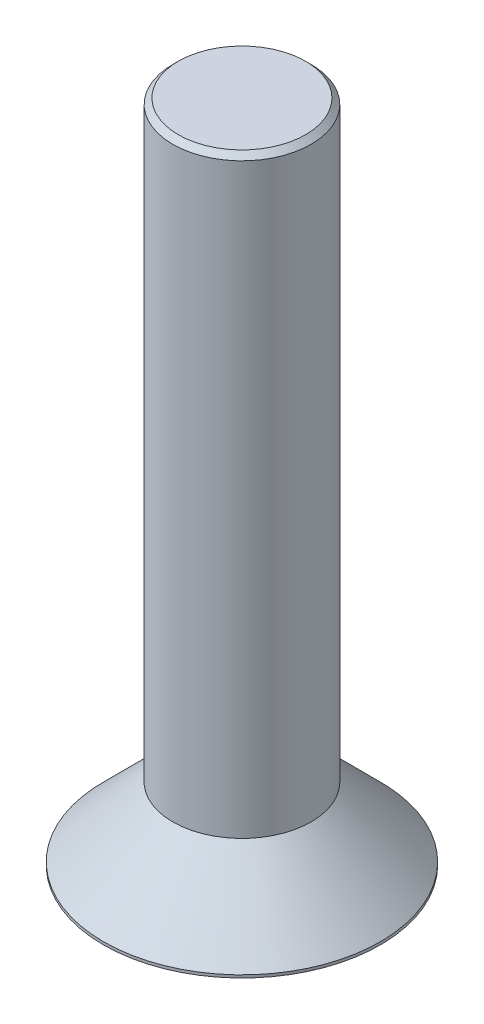
from build123d import *

# Parameters (mm, degrees)
SKETCH_1_R          = 5
EXTRUDE_1_DEPTH     = 2.6
CHAMFER_1_SIZE      = 2.5
CUT_EXTRUDE_1_DEPTH = 0.95
SKETCH_3_R          = 2.5
EXTRUDE_2_DEPTH     = 21.4
CHAMFER_2_SIZE      = 0.2


with BuildPart() as part:
    # 草图1 → 凸台-拉伸1 (new body)
    with BuildSketch(Plane(origin=(0, 0, 0), x_dir=(1, 0, 0), z_dir=(0, 1, 0))):
        with Locations(Location((0, 0, 0), (0, 0, 270))):
            Circle(SKETCH_1_R)
    extrude(amount=EXTRUDE_1_DEPTH)

    # 倒角1
    chamfer_1_edges = [part.edges().sort_by_distance(p)[0] for p in [
        (0, 2.6, -5),
    ]]
    chamfer(chamfer_1_edges, length=CHAMFER_1_SIZE)

    # 草图2 → 切除-拉伸1 (cut)
    with BuildSketch(Plane.XZ):
        Polygon((1.54, -0.889119415), (1.54, 0.889119415), (0, 1.778238829), (-1.54, 0.889119415), (-1.54, -0.889119415), (0, -1.778238829), align=None)
    extrude(amount=-CUT_EXTRUDE_1_DEPTH, mode=Mode.SUBTRACT)

    # 草图3 → 凸台-拉伸2 (add)
    with BuildSketch(Plane(origin=(0, 2.6, 0), x_dir=(1, 0, 0), z_dir=(0, 1, 0))):
        with Locations(Location((0, 0, 0), (0, 0, 270))):
            Circle(SKETCH_3_R)
    extrude(amount=EXTRUDE_2_DEPTH)

    # 倒角2
    chamfer_2_edges = [part.edges().sort_by_distance(p)[0] for p in [
        (0, 24, -2.5),
    ]]
    chamfer(chamfer_2_edges, length=CHAMFER_2_SIZE)


solid = part.part
